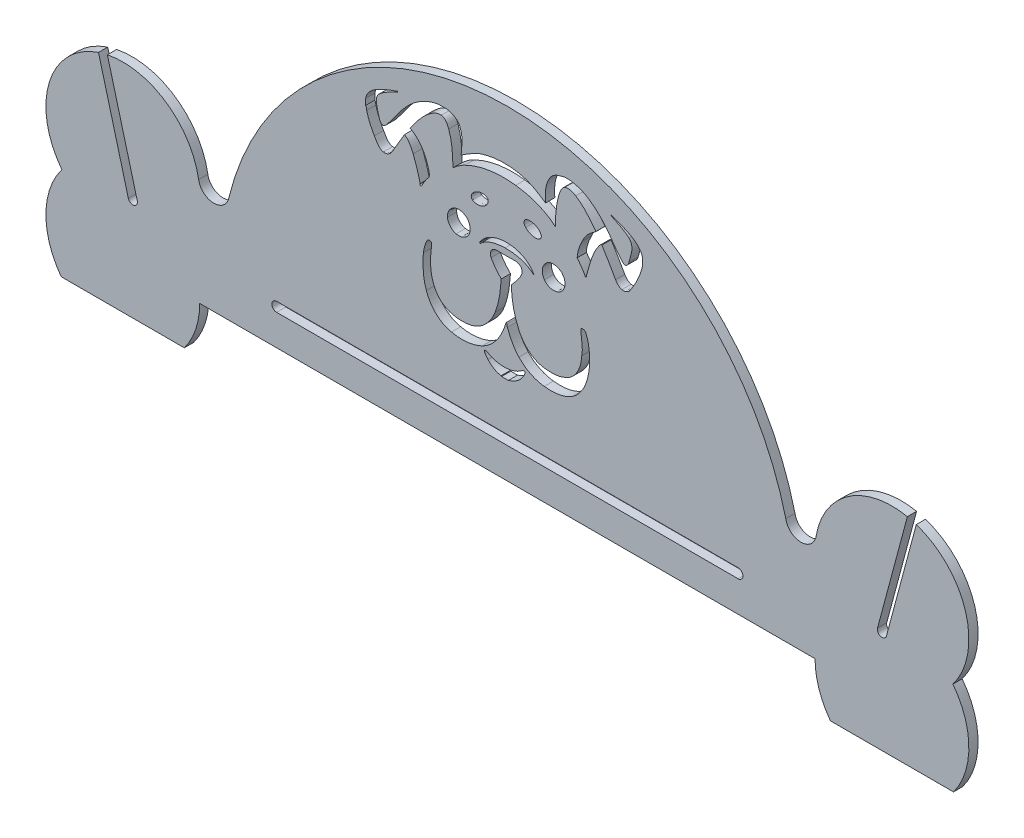
from build123d import *

# Parameters (mm, degrees)
RESSALTO_EXTRUS_O2_DEPTH = 6
RESSALTO_EXTRUS_O4_START = -6
RESSALTO_EXTRUS_O4_DEPTH = 6
CORTE_EXTRUS_O1_DEPTH    = 367.820119404


with BuildPart() as part:
    # Esboço1 → Ressalto-extrusão2 (new body)
    with BuildSketch(Plane.XY):
        with BuildLine():
            Line((-199.999999999, 0), (199.999999999, 0))
            ThreePointArc((199.999999999, 0), (202.565835097, -15.811388301), (209.999999999, -30))
            Line((209.999999999, -30), (289.999999999, -30))
            ThreePointArc((289.999999999, -30), (299.999014124, 0.31398499), (289.62007067, 30.5))
            ThreePointArc((289.62007067, 30.5), (297.818976076, 75.60635228), (265.815415017, 108.432822474))
            Line((265.815415017, 108.432822474), (246.403986634, 35.988385502))
            ThreePointArc((246.403986634, 35.988385502), (242.72975202, 33.867065158), (240.608431676, 37.541299773))
            Line((240.608431676, 37.541299773), (260.019860059, 109.985736744))
            ThreePointArc((260.019860059, 109.985736744), (218.38507475, 99.736242739), (199.999999999, 61))
            Line((199.999999999, 61), (140, 61))
            Line((140, 61), (-199.999999999, 61))
            ThreePointArc((-199.999999999, 61), (-218.38507475, 99.736242739), (-260.019860059, 109.985736744))
            Line((-260.019860059, 109.985736744), (-240.608431676, 37.541299773))
            ThreePointArc((-240.608431676, 37.541299773), (-242.72975202, 33.867065158), (-246.403986634, 35.988385502))
            Line((-246.403986634, 35.988385502), (-265.815415017, 108.432822474))
            ThreePointArc((-265.815415017, 108.432822474), (-297.818976076, 75.60635228), (-289.62007067, 30.5))
            ThreePointArc((-289.62007067, 30.5), (-299.999014124, 0.31398499), (-289.999999999, -30))
            Line((-289.999999999, -30), (-209.999999999, -30))
            ThreePointArc((-209.999999999, -30), (-202.565835097, -15.811388301), (-199.999999999, 0))
        make_face()
        with BuildLine():
            Line((149.999999999, 26.2), (144.152507453, 26.2))
            Line((144.152507453, 26.2), (-144.152507453, 26.2))
            Line((-144.152507453, 26.2), (-149.999999999, 26.2))
            ThreePointArc((-149.999999999, 26.2), (-153.099999999, 23.1), (-149.999999999, 20))
            Line((-149.999999999, 20), (149.999999999, 20))
            ThreePointArc((149.999999999, 20), (153.099999999, 23.1), (149.999999999, 26.2))
        make_face(mode=Mode.SUBTRACT)
    extrude(amount=RESSALTO_EXTRUS_O2_DEPTH)

    # Esboço7 → Ressalto-extrusão4 (add)
    with BuildSketch(Plane.XY.offset(6).offset(RESSALTO_EXTRUS_O4_START)):
        with BuildLine():
            ThreePointArc((-180.979069196, 69.333333333), (-184.384229959, 63.362373812), (-190.83920226, 61))
            Line((-190.83920226, 61), (190.839202168, 61))
            ThreePointArc((190.839202168, 61), (184.384229924, 63.362373842), (180.979069196, 69.333333333))
            ThreePointArc((180.979069196, 69.333333333), (0, 211), (-180.979069196, 69.333333333))
        make_face()
        with BuildLine():
            ThreePointArc((200.69933514, 69.333333333), (197.294174412, 63.362373842), (190.839202168, 61))
            Line((190.839202168, 61), (199.999999999, 61))
            ThreePointArc((199.999999999, 61), (200.175140526, 65.181313014), (200.69933514, 69.333333333))
        make_face()
        with BuildLine():
            ThreePointArc((200.69933514, 69.333333333), (200.175140526, 65.181313014), (199.999999999, 61))
            Line((199.999999999, 61), (209.323153762, 61))
            Line((209.323153762, 61), (200.69933514, 69.333333333))
        make_face()
        with BuildLine():
            ThreePointArc((-200.69933514, 69.333333333), (-200.175140526, 65.181313014), (-199.999999999, 61))
            Line((-199.999999999, 61), (-190.83920226, 61))
            ThreePointArc((-190.83920226, 61), (-197.294174447, 63.362373871), (-200.69933514, 69.333333333))
        make_face()
        with BuildLine():
            Line((-204.602499399, 61), (-199.999999999, 61))
            ThreePointArc((-199.999999999, 61), (-200.175140526, 65.181313014), (-200.69933514, 69.333333333))
            Line((-200.69933514, 69.333333333), (-204.602499399, 69.333333333))
            Line((-204.602499399, 69.333333333), (-204.602499399, 61))
        make_face()
    extrude(amount=RESSALTO_EXTRUS_O4_DEPTH)

    # Esboço8 → Corte-extrusão1 (cut, through all)
    with BuildSketch(Plane.XY.offset(6)):
        with BuildLine():
            Line((-44.7783, 189.738352158), (-39.1773, 189.738352158))
            add(Edge.make_bspline(
                [(-39.1773, 189.738352158), (-36.0719, 189.018252158), (-32.5885, 187.728852158), (-31.1078, 184.634952158)],
                knots=[0.016129032, 0.016129032, 0.016129032, 0.016129032, 0.032258065, 0.032258065, 0.032258065, 0.032258065], degree=3))
            add(Edge.make_bspline(
                [(-31.1078, 184.634952158), (-28.6572, 179.668352158), (-29.5867, 173.860352158), (-30.0502, 168.542852158)],
                knots=[0.032258065, 0.032258065, 0.032258065, 0.032258065, 0.048387097, 0.048387097, 0.048387097, 0.048387097], degree=3))
            add(Edge.make_bspline(
                [(-30.0502, 168.542852158), (-25.9705, 171.070052158), (-21.9875, 173.936952158), (-17.4035, 175.525652158)],
                knots=[0.048387097, 0.048387097, 0.048387097, 0.048387097, 0.064516129, 0.064516129, 0.064516129, 0.064516129], degree=3))
            add(Edge.make_bspline(
                [(-17.4035, 175.525652158), (-7.8804, 178.617552158), (2.7207, 178.930152158), (12.2934, 175.845152158)],
                knots=[0.064516129, 0.064516129, 0.064516129, 0.064516129, 0.080645161, 0.080645161, 0.080645161, 0.080645161], degree=3))
            add(Edge.make_bspline(
                [(12.2934, 175.845152158), (16.8276, 174.256452158), (20.8602, 171.585452158), (24.8432, 168.970552158)],
                knots=[0.080645161, 0.080645161, 0.080645161, 0.080645161, 0.096774194, 0.096774194, 0.096774194, 0.096774194], degree=3))
            add(Edge.make_bspline(
                [(24.8432, 168.970552158), (24.4225, 174.670552158), (24.6092, 181.050252158), (28.5111, 185.633952158)],
                knots=[0.096774194, 0.096774194, 0.096774194, 0.096774194, 0.112903226, 0.112903226, 0.112903226, 0.112903226], degree=3))
            add(Edge.make_bspline(
                [(28.5111, 185.633952158), (30.6353, 188.264452158), (34.0312, 189.000152158), (37.1274, 189.738352158)],
                knots=[0.112903226, 0.112903226, 0.112903226, 0.112903226, 0.129032258, 0.129032258, 0.129032258, 0.129032258], degree=3))
            Line((37.1274, 189.738352158), (41.16, 189.738352158))
            add(Edge.make_bspline(
                [(41.16, 189.738352158), (43.8266, 189.027352158), (46.7114, 188.662752158), (49.2047, 187.305852158)],
                knots=[0.14516129, 0.14516129, 0.14516129, 0.14516129, 0.161290323, 0.161290323, 0.161290323, 0.161290323], degree=3))
            add(Edge.make_bspline(
                [(49.2047, 187.305852158), (55.9174, 184.083252158), (61.3586, 178.727852158), (65.742, 172.795952158)],
                knots=[0.161290323, 0.161290323, 0.161290323, 0.161290323, 0.177419355, 0.177419355, 0.177419355, 0.177419355], degree=3))
            add(Edge.make_bspline(
                [(65.742, 172.795952158), (68.8317, 168.698252158), (71.4938, 164.213452158), (75.1032, 160.545552158)],
                knots=[0.177419355, 0.177419355, 0.177419355, 0.177419355, 0.193548387, 0.193548387, 0.193548387, 0.193548387], degree=3))
            add(Edge.make_bspline(
                [(75.1032, 160.545552158), (76.8765, 158.596652158), (78.7081, 161.058452158), (79.039, 162.804652158)],
                knots=[0.193548387, 0.193548387, 0.193548387, 0.193548387, 0.209677419, 0.209677419, 0.209677419, 0.209677419], degree=3))
            add(Edge.make_bspline(
                [(79.039, 162.804652158), (80.0583, 167.039752158), (82.6957, 172.561952158), (79.1313, 176.274852158)],
                knots=[0.209677419, 0.209677419, 0.209677419, 0.209677419, 0.225806452, 0.225806452, 0.225806452, 0.225806452], degree=3))
            add(Edge.make_bspline(
                [(79.1313, 176.274852158), (76.2463, 178.937152158), (72.6324, 180.584152158), (69.1196, 182.242652158)],
                knots=[0.225806452, 0.225806452, 0.225806452, 0.225806452, 0.241935484, 0.241935484, 0.241935484, 0.241935484], degree=3))
            add(Edge.make_bspline(
                [(69.1196, 182.242652158), (68.521, 182.598252158), (67.567, 182.717652158), (67.3555, 183.457752158)],
                knots=[0.241935484, 0.241935484, 0.241935484, 0.241935484, 0.258064516, 0.258064516, 0.258064516, 0.258064516], degree=3))
            add(Edge.make_bspline(
                [(67.3555, 183.457752158), (70.8704, 182.611652158), (74.2684, 181.173752158), (77.5561, 179.652752158)],
                knots=[0.258064516, 0.258064516, 0.258064516, 0.258064516, 0.274193548, 0.274193548, 0.274193548, 0.274193548], degree=3))
            add(Edge.make_bspline(
                [(77.5561, 179.652752158), (81.8832, 177.559752158), (86.5324, 174.722352158), (87.8647, 169.798652158)],
                knots=[0.274193548, 0.274193548, 0.274193548, 0.274193548, 0.290322581, 0.290322581, 0.290322581, 0.290322581], degree=3))
            Line((87.8647, 169.798652158), (87.8647, 165.109152158))
            add(Edge.make_bspline(
                [(87.8647, 165.109152158), (86.4175, 158.643952158), (83.4383, 152.534452158), (79.6892, 147.066452158)],
                knots=[0.306451613, 0.306451613, 0.306451613, 0.306451613, 0.322580645, 0.322580645, 0.322580645, 0.322580645], degree=3))
            add(Edge.make_bspline(
                [(79.6892, 147.066452158), (78.4066, 145.596952158), (76.4669, 144.541452158), (74.4596, 145.047752158)],
                knots=[0.322580645, 0.322580645, 0.322580645, 0.322580645, 0.338709677, 0.338709677, 0.338709677, 0.338709677], degree=3))
            add(Edge.make_bspline(
                [(74.4596, 145.047752158), (72.6009, 145.457352158), (71.1877, 146.917752158), (70.2989, 148.542352158)],
                knots=[0.338709677, 0.338709677, 0.338709677, 0.338709677, 0.35483871, 0.35483871, 0.35483871, 0.35483871], degree=3))
            add(Edge.make_bspline(
                [(70.2989, 148.542352158), (67.4612, 153.616852158), (64.5921, 158.682252158), (61.4305, 163.565352158)],
                knots=[0.35483871, 0.35483871, 0.35483871, 0.35483871, 0.370967742, 0.370967742, 0.370967742, 0.370967742], degree=3))
            add(Edge.make_bspline(
                [(61.4305, 163.565352158), (60.6811, 163.873552158), (60.3009, 162.807052158), (59.7967, 162.455952158)],
                knots=[0.370967742, 0.370967742, 0.370967742, 0.370967742, 0.387096774, 0.387096774, 0.387096774, 0.387096774], degree=3))
            add(Edge.make_bspline(
                [(59.7967, 162.455952158), (55.204, 156.524152158), (53.5433, 149.001552158), (51.5427, 141.926752158)],
                knots=[0.387096774, 0.387096774, 0.387096774, 0.387096774, 0.403225806, 0.403225806, 0.403225806, 0.403225806], degree=3))
            add(Edge.make_bspline(
                [(51.5427, 141.926752158), (51.3402, 141.751252158), (51.4618, 139.658352158), (50.6921, 140.405452158)],
                knots=[0.403225806, 0.403225806, 0.403225806, 0.403225806, 0.419354839, 0.419354839, 0.419354839, 0.419354839], degree=3))
            add(Edge.make_bspline(
                [(50.6921, 140.405452158), (49.2295, 143.265652158), (47.2987, 145.846652158), (45.4017, 148.412052158)],
                knots=[0.419354839, 0.419354839, 0.419354839, 0.419354839, 0.435483871, 0.435483871, 0.435483871, 0.435483871], degree=3))
            add(Edge.make_bspline(
                [(45.4017, 148.412052158), (45.4469, 152.230852158), (46.9252, 155.858252158), (48.5903, 159.238052158)],
                knots=[0.435483871, 0.435483871, 0.435483871, 0.435483871, 0.451612903, 0.451612903, 0.451612903, 0.451612903], degree=3))
            add(Edge.make_bspline(
                [(48.5903, 159.238052158), (50.2039, 162.833852158), (52.7737, 166.029452158), (56.1445, 168.115352158)],
                knots=[0.451612903, 0.451612903, 0.451612903, 0.451612903, 0.467741935, 0.467741935, 0.467741935, 0.467741935], degree=3))
            add(Edge.make_bspline(
                [(56.1445, 168.115352158), (56.6105, 168.452952158), (57.2135, 168.720752158), (57.5127, 169.251852158)],
                knots=[0.467741935, 0.467741935, 0.467741935, 0.467741935, 0.483870968, 0.483870968, 0.483870968, 0.483870968], degree=3))
            add(Edge.make_bspline(
                [(57.5127, 169.251852158), (53.7818, 174.272152158), (49.801, 179.400652158), (44.4432, 182.776152158)],
                knots=[0.483870968, 0.483870968, 0.483870968, 0.483870968, 0.5, 0.5, 0.5, 0.5], degree=3))
            add(Edge.make_bspline(
                [(44.4432, 182.776152158), (41.9363, 184.263352158), (38.1514, 185.573152158), (35.9326, 182.942452158)],
                knots=[0.5, 0.5, 0.5, 0.5, 0.516129032, 0.516129032, 0.516129032, 0.516129032], degree=3))
            add(Edge.make_bspline(
                [(35.9326, 182.942452158), (33.626, 179.947552158), (32.987, 176.130852158), (32.2263, 172.523752158)],
                knots=[0.516129032, 0.516129032, 0.516129032, 0.516129032, 0.532258065, 0.532258065, 0.532258065, 0.532258065], degree=3))
            add(Edge.make_bspline(
                [(32.2263, 172.523752158), (31.6682, 167.991552158), (31.0832, 163.448452158), (31.1304, 158.866852158)],
                knots=[0.532258065, 0.532258065, 0.532258065, 0.532258065, 0.548387097, 0.548387097, 0.548387097, 0.548387097], degree=3))
            add(Edge.make_bspline(
                [(31.1304, 158.866852158), (23.9992, 165.030352158), (14.7191, 168.072652158), (5.4819, 169.238252158)],
                knots=[0.548387097, 0.548387097, 0.548387097, 0.548387097, 0.564516129, 0.564516129, 0.564516129, 0.564516129], degree=3))
            add(Edge.make_bspline(
                [(5.4819, 169.238252158), (-5.6999, 170.565852158), (-17.4081, 169.132552158), (-27.5524, 164.053652158)],
                knots=[0.564516129, 0.564516129, 0.564516129, 0.564516129, 0.580645161, 0.580645161, 0.580645161, 0.580645161], degree=3))
            add(Edge.make_bspline(
                [(-27.5524, 164.053652158), (-30.4733, 162.701352158), (-33.0521, 160.766052158), (-35.4149, 158.607852158)],
                knots=[0.580645161, 0.580645161, 0.580645161, 0.580645161, 0.596774194, 0.596774194, 0.596774194, 0.596774194], degree=3))
            add(Edge.make_bspline(
                [(-35.4149, 158.607852158), (-35.5071, 165.513952158), (-35.8267, 172.584652158), (-38.1556, 179.159852158)],
                knots=[0.596774194, 0.596774194, 0.596774194, 0.596774194, 0.612903226, 0.612903226, 0.612903226, 0.612903226], degree=3))
            add(Edge.make_bspline(
                [(-38.1556, 179.159852158), (-39.0356, 181.396652158), (-40.3071, 184.108052158), (-42.96, 184.477252158)],
                knots=[0.612903226, 0.612903226, 0.612903226, 0.612903226, 0.629032258, 0.629032258, 0.629032258, 0.629032258], degree=3))
            add(Edge.make_bspline(
                [(-42.96, 184.477252158), (-45.8202, 184.706652158), (-48.3405, 183.030352158), (-50.5817, 181.471052158)],
                knots=[0.629032258, 0.629032258, 0.629032258, 0.629032258, 0.64516129, 0.64516129, 0.64516129, 0.64516129], degree=3))
            add(Edge.make_bspline(
                [(-50.5817, 181.471052158), (-55.6877, 177.514752158), (-59.6886, 172.334852158), (-63.3206, 167.044252158)],
                knots=[0.64516129, 0.64516129, 0.64516129, 0.64516129, 0.661290323, 0.661290323, 0.661290323, 0.661290323], degree=3))
            add(Edge.make_bspline(
                [(-63.3206, 167.044252158), (-56.2771, 163.675552158), (-52.7083, 156.114752158), (-50.8856, 148.902552158)],
                knots=[0.661290323, 0.661290323, 0.661290323, 0.661290323, 0.677419355, 0.677419355, 0.677419355, 0.677419355], degree=3))
            add(Edge.make_bspline(
                [(-50.8856, 148.902552158), (-50.8067, 147.624352158), (-50.2847, 145.921052158), (-51.4616, 144.989352158)],
                knots=[0.677419355, 0.677419355, 0.677419355, 0.677419355, 0.693548387, 0.693548387, 0.693548387, 0.693548387], degree=3))
            add(Edge.make_bspline(
                [(-51.4616, 144.989352158), (-53.1719, 142.945952158), (-54.5467, 140.643952158), (-55.7957, 138.296852158)],
                knots=[0.693548387, 0.693548387, 0.693548387, 0.693548387, 0.709677419, 0.709677419, 0.709677419, 0.709677419], degree=3))
            add(Edge.make_bspline(
                [(-55.7957, 138.296852158), (-56.0027, 137.619652158), (-57.5712, 138.011052158), (-56.6598, 139.091252158)],
                knots=[0.709677419, 0.709677419, 0.709677419, 0.709677419, 0.725806452, 0.725806452, 0.725806452, 0.725806452], degree=3))
            add(Edge.make_bspline(
                [(-56.6598, 139.091252158), (-57.938, 144.003752158), (-59.2454, 148.947552158), (-61.2414, 153.625752158)],
                knots=[0.725806452, 0.725806452, 0.725806452, 0.725806452, 0.741935484, 0.741935484, 0.741935484, 0.741935484], degree=3))
            add(Edge.make_bspline(
                [(-61.2414, 153.625752158), (-62.65, 156.517552158), (-63.9754, 159.987452158), (-66.8963, 161.598652158)],
                knots=[0.741935484, 0.741935484, 0.741935484, 0.741935484, 0.758064516, 0.758064516, 0.758064516, 0.758064516], degree=3))
            add(Edge.make_bspline(
                [(-66.8963, 161.598652158), (-69.349, 157.883452158), (-71.4644, 153.961052158), (-73.6674, 150.095152158)],
                knots=[0.758064516, 0.758064516, 0.758064516, 0.758064516, 0.774193548, 0.774193548, 0.774193548, 0.774193548], degree=3))
            add(Edge.make_bspline(
                [(-73.6674, 150.095152158), (-74.8961, 147.394752158), (-77.2274, 144.278052158), (-80.6455, 144.991652158)],
                knots=[0.774193548, 0.774193548, 0.774193548, 0.774193548, 0.790322581, 0.790322581, 0.790322581, 0.790322581], degree=3))
            add(Edge.make_bspline(
                [(-80.6455, 144.991652158), (-83.7171, 145.572152158), (-84.9706, 148.738252158), (-86.4671, 151.085252158)],
                knots=[0.790322581, 0.790322581, 0.790322581, 0.790322581, 0.806451613, 0.806451613, 0.806451613, 0.806451613], degree=3))
            add(Edge.make_bspline(
                [(-86.4671, 151.085252158), (-88.571, 154.832052158), (-90.5198, 158.747452158), (-91.4648, 162.962352158)],
                knots=[0.806451613, 0.806451613, 0.806451613, 0.806451613, 0.822580645, 0.822580645, 0.822580645, 0.822580645], degree=3))
            add(Edge.make_bspline(
                [(-91.4648, 162.962352158), (-91.6765, 163.761052158), (-91.5278, 164.712952158), (-92.1581, 165.342952158)],
                knots=[0.822580645, 0.822580645, 0.822580645, 0.822580645, 0.838709677, 0.838709677, 0.838709677, 0.838709677], degree=3))
            Line((-92.1581, 165.342952158), (-92.1581, 169.364352158))
            add(Edge.make_bspline(
                [(-92.1581, 169.364352158), (-91.1228, 174.821352158), (-85.8324, 177.771352158), (-81.1811, 179.911452158)],
                knots=[0.85483871, 0.85483871, 0.85483871, 0.85483871, 0.870967742, 0.870967742, 0.870967742, 0.870967742], degree=3))
            add(Edge.make_bspline(
                [(-81.1811, 179.911452158), (-78.3773, 181.288552158), (-75.4203, 182.310252158), (-72.4703, 183.307252158)],
                knots=[0.870967742, 0.870967742, 0.870967742, 0.870967742, 0.887096774, 0.887096774, 0.887096774, 0.887096774], degree=3))
            add(Edge.make_bspline(
                [(-72.4703, 183.307252158), (-71.0031, 184.434552158), (-71.2753, 183.014452158), (-71.8853, 182.951552158)],
                knots=[0.887096774, 0.887096774, 0.887096774, 0.887096774, 0.903225806, 0.903225806, 0.903225806, 0.903225806], degree=3))
            add(Edge.make_bspline(
                [(-71.8853, 182.951552158), (-75.8951, 181.072452158), (-80.0694, 179.234152158), (-83.3594, 176.216452158)],
                knots=[0.903225806, 0.903225806, 0.903225806, 0.903225806, 0.919354839, 0.919354839, 0.919354839, 0.919354839], degree=3))
            add(Edge.make_bspline(
                [(-83.3594, 176.216452158), (-86.3657, 173.498252158), (-84.9346, 169.188952158), (-84.1807, 165.797652158)],
                knots=[0.919354839, 0.919354839, 0.919354839, 0.919354839, 0.935483871, 0.935483871, 0.935483871, 0.935483871], degree=3))
            add(Edge.make_bspline(
                [(-84.1807, 165.797652158), (-83.4809, 163.882752158), (-83.3795, 161.513052158), (-81.7302, 160.108852158)],
                knots=[0.935483871, 0.935483871, 0.935483871, 0.935483871, 0.951612903, 0.951612903, 0.951612903, 0.951612903], degree=3))
            add(Edge.make_bspline(
                [(-81.7302, 160.108852158), (-80.5893, 159.258252158), (-79.2908, 160.471252158), (-78.5842, 161.312852158)],
                knots=[0.951612903, 0.951612903, 0.951612903, 0.951612903, 0.967741935, 0.967741935, 0.967741935, 0.967741935], degree=3))
            add(Edge.make_bspline(
                [(-78.5842, 161.312852158), (-73.9014, 166.459252158), (-70.724, 172.822952158), (-65.8049, 177.782552158)],
                knots=[0.967741935, 0.967741935, 0.967741935, 0.967741935, 0.983870968, 0.983870968, 0.983870968, 0.983870968], degree=3))
            add(Edge.make_bspline(
                [(-65.8049, 177.782552158), (-60.2962, 183.858452158), (-52.9423, 188.505252158), (-44.7783, 189.738352158)],
                knots=[0.983870968, 0.983870968, 0.983870968, 0.983870968, 1, 1, 1, 1], degree=3))
        make_face()
        with BuildLine():
            Line((0.6392, 56.971752158), (-3.8029, 56.971752158))
            add(Edge.make_bspline(
                [(-3.8029, 56.971752158), (-3.866, 57.057252158), (-3.9942, 57.230552158), (-4.0572, 57.316052158)],
                knots=[0.444444444, 0.444444444, 0.444444444, 0.444444444, 0.555555556, 0.555555556, 0.555555556, 0.555555556], degree=3))
            add(Edge.make_bspline(
                [(-4.0572, 57.316052158), (-7.3921, 57.675952158), (-10.3468, 59.651852158), (-12.5632, 62.084552158)],
                knots=[0.555555556, 0.555555556, 0.555555556, 0.555555556, 0.666666667, 0.666666667, 0.666666667, 0.666666667], degree=3))
            add(Edge.make_bspline(
                [(-12.5632, 62.084552158), (-13.4003, 63.337752158), (-15.3243, 64.710452158), (-14.7101, 66.411752158)],
                knots=[0.666666667, 0.666666667, 0.666666667, 0.666666667, 0.777777778, 0.777777778, 0.777777778, 0.777777778], degree=3))
            add(Edge.make_bspline(
                [(-14.7101, 66.411752158), (-12.9637, 66.695152158), (-11.7577, 65.138152158), (-10.1599, 64.735352158)],
                knots=[0.777777778, 0.777777778, 0.777777778, 0.777777778, 0.888888889, 0.888888889, 0.888888889, 0.888888889], degree=3))
            add(Edge.make_bspline(
                [(-10.1599, 64.735352158), (-3.5959, 62.106852158), (4.4444, 62.718952158), (10.0184, 67.286952158)],
                knots=[0.888888889, 0.888888889, 0.888888889, 0.888888889, 1, 1, 1, 1], degree=3))
            add(Edge.make_bspline(
                [(10.0184, 67.286952158), (10.3535, 67.298152158), (11.022, 67.318552158), (11.355, 67.329752158)],
                knots=[0, 0, 0, 0, 0.111111111, 0.111111111, 0.111111111, 0.111111111], degree=3))
            add(Edge.make_bspline(
                [(11.355, 67.329752158), (11.6588, 65.515952158), (10.3267, 64.150352158), (9.4153, 62.746152158)],
                knots=[0.111111111, 0.111111111, 0.111111111, 0.111111111, 0.222222222, 0.222222222, 0.222222222, 0.222222222], degree=3))
            add(Edge.make_bspline(
                [(9.4153, 62.746152158), (7.3045, 59.811552158), (4.0349, 57.966352158), (0.6392, 56.971752158)],
                knots=[0.222222222, 0.222222222, 0.222222222, 0.222222222, 0.333333333, 0.333333333, 0.333333333, 0.333333333], degree=3))
        make_face()
        with BuildLine():
            add(Edge.make_bspline(
                [(-18.2609, 153.639452158), (-16.265, 153.841752158), (-13.8459, 154.249052158), (-12.534, 152.318452158)],
                knots=[0, 0, 0, 0, 0.25, 0.25, 0.25, 0.25], degree=3))
            add(Edge.make_bspline(
                [(-12.534, 152.318452158), (-11.7285, 147.349852158), (-19.0688, 144.464852158), (-22.6873, 146.913352158)],
                knots=[0.25, 0.25, 0.25, 0.25, 0.5, 0.5, 0.5, 0.5], degree=3))
            add(Edge.make_bspline(
                [(-22.6873, 146.913352158), (-23.7629, 147.745952158), (-23.6819, 149.426752158), (-22.9416, 150.448452158)],
                knots=[0.5, 0.5, 0.5, 0.5, 0.75, 0.75, 0.75, 0.75], degree=3))
            add(Edge.make_bspline(
                [(-22.9416, 150.448452158), (-21.893, 152.111552158), (-20.0027, 152.901352158), (-18.2609, 153.639452158)],
                knots=[0.75, 0.75, 0.75, 0.75, 1, 1, 1, 1], degree=3))
        make_face()
        with BuildLine():
            add(Edge.make_bspline(
                [(12.7861, 153.657352158), (16.0017, 154.294152158), (20.0275, 153.115052158), (21.6524, 150.104152158)],
                knots=[0, 0, 0, 0, 0.25, 0.25, 0.25, 0.25], degree=3))
            add(Edge.make_bspline(
                [(21.6524, 150.104152158), (22.4804, 148.801252158), (21.9921, 146.908852158), (20.4619, 146.397952158)],
                knots=[0.25, 0.25, 0.25, 0.25, 0.5, 0.5, 0.5, 0.5], degree=3))
            add(Edge.make_bspline(
                [(20.4619, 146.397952158), (17.4735, 145.342652158), (13.9159, 146.478852158), (11.8522, 148.830552158)],
                knots=[0.5, 0.5, 0.5, 0.5, 0.75, 0.75, 0.75, 0.75], degree=3))
            add(Edge.make_bspline(
                [(11.8522, 148.830552158), (10.2006, 150.218952158), (10.617, 153.148752158), (12.7861, 153.657352158)],
                knots=[0.75, 0.75, 0.75, 0.75, 1, 1, 1, 1], degree=3))
        make_face()
        with BuildLine():
            add(Edge.make_bspline(
                [(-33.1129, 136.982752158), (-30.4395, 137.597152158), (-27.6942, 136.447252158), (-25.8309, 134.559152158)],
                knots=[0, 0, 0, 0, 0.2, 0.2, 0.2, 0.2], degree=3))
            add(Edge.make_bspline(
                [(-25.8309, 134.559152158), (-24.3953, 132.448252158), (-23.5785, 129.626652158), (-24.6316, 127.171552158)],
                knots=[0.2, 0.2, 0.2, 0.2, 0.4, 0.4, 0.4, 0.4], degree=3))
            add(Edge.make_bspline(
                [(-24.6316, 127.171552158), (-25.7477, 123.751152158), (-29.8454, 121.651752158), (-33.2883, 122.572152158)],
                knots=[0.4, 0.4, 0.4, 0.4, 0.6, 0.6, 0.6, 0.6], degree=3))
            add(Edge.make_bspline(
                [(-33.2883, 122.572152158), (-36.3037, 123.197652158), (-38.698, 126.001452158), (-38.9569, 129.066252158)],
                knots=[0.6, 0.6, 0.6, 0.6, 0.8, 0.8, 0.8, 0.8], degree=3))
            add(Edge.make_bspline(
                [(-38.9569, 129.066252158), (-39.2471, 132.639652158), (-36.675, 136.276352158), (-33.1129, 136.982752158)],
                knots=[0.8, 0.8, 0.8, 0.8, 1, 1, 1, 1], degree=3))
        make_face()
        with BuildLine():
            add(Edge.make_bspline(
                [(28.3221, 136.980452158), (31.279, 137.498152158), (34.8096, 136.454152158), (36.2836, 133.656952158)],
                knots=[0, 0, 0, 0, 0.25, 0.25, 0.25, 0.25], degree=3))
            add(Edge.make_bspline(
                [(36.2836, 133.656952158), (38.1108, 131.098252158), (37.8025, 127.407752158), (35.7682, 125.056452158)],
                knots=[0.25, 0.25, 0.25, 0.25, 0.5, 0.5, 0.5, 0.5], degree=3))
            add(Edge.make_bspline(
                [(35.7682, 125.056452158), (32.906, 121.361352158), (26.6592, 121.474052158), (24.0421, 125.461252158)],
                knots=[0.5, 0.5, 0.5, 0.5, 0.75, 0.75, 0.75, 0.75], degree=3))
            add(Edge.make_bspline(
                [(24.0421, 125.461252158), (20.9682, 129.516352158), (23.4098, 135.823752158), (28.3221, 136.980452158)],
                knots=[0.75, 0.75, 0.75, 0.75, 1, 1, 1, 1], degree=3))
        make_face()
        with BuildLine():
            add(Edge.make_bspline(
                [(-4.3025, 133.821152158), (3.6545, 134.950852158), (12.9077, 132.477652158), (17.1742, 125.128252158)],
                knots=[0, 0, 0, 0, 0.166666667, 0.166666667, 0.166666667, 0.166666667], degree=3))
            add(Edge.make_bspline(
                [(17.1742, 125.128252158), (17.4038, 124.727852158), (16.6049, 124.952752158), (16.4744, 125.105852158)],
                knots=[0.166666667, 0.166666667, 0.166666667, 0.166666667, 0.333333333, 0.333333333, 0.333333333, 0.333333333], degree=3))
            add(Edge.make_bspline(
                [(16.4744, 125.105852158), (11.6453, 129.475852158), (4.7999, 130.569552158), (-1.4693, 130.533652158)],
                knots=[0.333333333, 0.333333333, 0.333333333, 0.333333333, 0.5, 0.5, 0.5, 0.5], degree=3))
            add(Edge.make_bspline(
                [(-1.4693, 130.533652158), (-6.9082, 130.369252158), (-12.705, 129.187752158), (-16.94, 125.551552158)],
                knots=[0.5, 0.5, 0.5, 0.5, 0.666666667, 0.666666667, 0.666666667, 0.666666667], degree=3))
            add(Edge.make_bspline(
                [(-16.94, 125.551552158), (-17.1605, 125.204852158), (-18.0428, 124.540952158), (-18.1237, 125.153052158)],
                knots=[0.666666667, 0.666666667, 0.666666667, 0.666666667, 0.833333333, 0.833333333, 0.833333333, 0.833333333], degree=3))
            add(Edge.make_bspline(
                [(-18.1237, 125.153052158), (-15.3919, 130.119552158), (-9.8021, 132.977252158), (-4.3025, 133.821152158)],
                knots=[0.833333333, 0.833333333, 0.833333333, 0.833333333, 1, 1, 1, 1], degree=3))
        make_face()
        with BuildLine():
            add(Edge.make_bspline(
                [(-7.4596, 126.406452158), (-3.3709, 126.636052158), (0.736, 126.444652158), (4.8314, 126.509952158)],
                knots=[0, 0, 0, 0, 0.035714286, 0.035714286, 0.035714286, 0.035714286], degree=3))
            add(Edge.make_bspline(
                [(4.8314, 126.509952158), (6.2379, 126.478552158), (7.7972, 126.111752158), (8.7515, 125.018052158)],
                knots=[0.035714286, 0.035714286, 0.035714286, 0.035714286, 0.071428571, 0.071428571, 0.071428571, 0.071428571], degree=3))
            add(Edge.make_bspline(
                [(8.7515, 125.018052158), (9.9283, 123.445052158), (9.593, 121.347752158), (8.6861, 119.727652158)],
                knots=[0.071428571, 0.071428571, 0.071428571, 0.071428571, 0.107142857, 0.107142857, 0.107142857, 0.107142857], degree=3))
            add(Edge.make_bspline(
                [(8.6861, 119.727652158), (7.0592, 116.809052158), (4.8156, 114.306552158), (2.6396, 111.793152158)],
                knots=[0.107142857, 0.107142857, 0.107142857, 0.107142857, 0.142857143, 0.142857143, 0.142857143, 0.142857143], degree=3))
            add(Edge.make_bspline(
                [(2.6396, 111.793152158), (2.7364, 104.065552158), (4.0664, 96.234752158), (7.3451, 89.184452158)],
                knots=[0.142857143, 0.142857143, 0.142857143, 0.142857143, 0.178571429, 0.178571429, 0.178571429, 0.178571429], degree=3))
            add(Edge.make_bspline(
                [(7.3451, 89.184452158), (10.187, 82.456052158), (16.1752, 76.751652158), (23.5719, 75.712152158)],
                knots=[0.178571429, 0.178571429, 0.178571429, 0.178571429, 0.214285714, 0.214285714, 0.214285714, 0.214285714], degree=3))
            add(Edge.make_bspline(
                [(23.5719, 75.712152158), (28.0768, 75.147352158), (32.9938, 75.041652158), (37.2332, 76.999352158)],
                knots=[0.214285714, 0.214285714, 0.214285714, 0.214285714, 0.25, 0.25, 0.25, 0.25], degree=3))
            add(Edge.make_bspline(
                [(37.2332, 76.999352158), (44.4071, 79.483552158), (48.0706, 87.393252158), (48.2844, 94.549152158)],
                knots=[0.25, 0.25, 0.25, 0.25, 0.285714286, 0.285714286, 0.285714286, 0.285714286], degree=3))
            add(Edge.make_bspline(
                [(48.2844, 94.549152158), (49.4951, 99.605552158), (47.67, 104.727152158), (47.841, 109.810552158)],
                knots=[0.285714286, 0.285714286, 0.285714286, 0.285714286, 0.321428571, 0.321428571, 0.321428571, 0.321428571], degree=3))
            add(Edge.make_bspline(
                [(47.841, 109.810552158), (49.0113, 110.469752158), (50.5527, 110.112252158), (51.0431, 108.806952158)],
                knots=[0.321428571, 0.321428571, 0.321428571, 0.321428571, 0.357142857, 0.357142857, 0.357142857, 0.357142857], degree=3))
            add(Edge.make_bspline(
                [(51.0431, 108.806952158), (53.3542, 103.577352158), (53.5005, 97.724452158), (53.3879, 92.100752158)],
                knots=[0.357142857, 0.357142857, 0.357142857, 0.357142857, 0.392857143, 0.392857143, 0.392857143, 0.392857143], degree=3))
            add(Edge.make_bspline(
                [(53.3879, 92.100752158), (52.9357, 83.489052158), (49.8821, 74.177452158), (42.5642, 68.979352158)],
                knots=[0.392857143, 0.392857143, 0.392857143, 0.392857143, 0.428571429, 0.428571429, 0.428571429, 0.428571429], degree=3))
            add(Edge.make_bspline(
                [(42.5642, 68.979352158), (37.1455, 65.320452158), (30.2754, 64.489952158), (23.9543, 65.286552158)],
                knots=[0.428571429, 0.428571429, 0.428571429, 0.428571429, 0.464285714, 0.464285714, 0.464285714, 0.464285714], degree=3))
            add(Edge.make_bspline(
                [(23.9543, 65.286552158), (17.7548, 65.977452158), (11.7218, 68.916252158), (7.4755, 73.565452158)],
                knots=[0.464285714, 0.464285714, 0.464285714, 0.464285714, 0.5, 0.5, 0.5, 0.5], degree=3))
            add(Edge.make_bspline(
                [(7.4755, 73.565452158), (3.9943, 77.251352158), (1.6473, 81.837352158), (0, 86.592252158)],
                knots=[0.5, 0.5, 0.5, 0.5, 0.535714286, 0.535714286, 0.535714286, 0.535714286], degree=3))
            add(Edge.make_bspline(
                [(0, 86.592252158), (-0.477, 87.226852158), (0.0181, 89.024652158), (-0.8663, 88.774952158)],
                knots=[0.535714286, 0.535714286, 0.535714286, 0.535714286, 0.571428571, 0.571428571, 0.571428571, 0.571428571], degree=3))
            add(Edge.make_bspline(
                [(-0.8663, 88.774952158), (-3.2336, 80.325152158), (-8.1414, 71.990252158), (-16.274, 67.959752158)],
                knots=[0.571428571, 0.571428571, 0.571428571, 0.571428571, 0.607142857, 0.607142857, 0.607142857, 0.607142857], degree=3))
            add(Edge.make_bspline(
                [(-16.274, 67.959752158), (-22.442, 64.985052158), (-29.7081, 64.192952158), (-36.3533, 65.734452158)],
                knots=[0.607142857, 0.607142857, 0.607142857, 0.607142857, 0.642857143, 0.642857143, 0.642857143, 0.642857143], degree=3))
            add(Edge.make_bspline(
                [(-36.3533, 65.734452158), (-44.092, 67.233052158), (-50.2262, 73.585552158), (-52.6678, 80.966552158)],
                knots=[0.642857143, 0.642857143, 0.642857143, 0.642857143, 0.678571429, 0.678571429, 0.678571429, 0.678571429], degree=3))
            add(Edge.make_bspline(
                [(-52.6678, 80.966552158), (-55.0261, 87.415952158), (-55.1251, 94.394152158), (-54.6503, 101.147152158)],
                knots=[0.678571429, 0.678571429, 0.678571429, 0.678571429, 0.714285714, 0.714285714, 0.714285714, 0.714285714], degree=3))
            add(Edge.make_bspline(
                [(-54.6503, 101.147152158), (-54.126, 104.011652158), (-53.6082, 107.044952158), (-52.0535, 109.576552158)],
                knots=[0.714285714, 0.714285714, 0.714285714, 0.714285714, 0.75, 0.75, 0.75, 0.75], degree=3))
            add(Edge.make_bspline(
                [(-52.0535, 109.576552158), (-51.3131, 110.605052158), (-48.8805, 110.346252158), (-49.218, 108.757452158)],
                knots=[0.75, 0.75, 0.75, 0.75, 0.785714286, 0.785714286, 0.785714286, 0.785714286], degree=3))
            add(Edge.make_bspline(
                [(-49.218, 108.757452158), (-50.3545, 99.657252158), (-50.9666, 89.168852158), (-44.8414, 81.560552158)],
                knots=[0.785714286, 0.785714286, 0.785714286, 0.785714286, 0.821428571, 0.821428571, 0.821428571, 0.821428571], degree=3))
            add(Edge.make_bspline(
                [(-44.8414, 81.560552158), (-39.8209, 75.473552158), (-31.0223, 74.467752158), (-23.7471, 75.894352158)],
                knots=[0.821428571, 0.821428571, 0.821428571, 0.821428571, 0.857142857, 0.857142857, 0.857142857, 0.857142857], degree=3))
            add(Edge.make_bspline(
                [(-23.7471, 75.894352158), (-16.148, 77.645052158), (-10.6168, 84.071952158), (-7.9232, 91.135552158)],
                knots=[0.857142857, 0.857142857, 0.857142857, 0.857142857, 0.892857143, 0.892857143, 0.892857143, 0.892857143], degree=3))
            add(Edge.make_bspline(
                [(-7.9232, 91.135552158), (-5.3645, 97.742252158), (-4.4218, 104.790352158), (-3.9784, 111.813352158)],
                knots=[0.892857143, 0.892857143, 0.892857143, 0.892857143, 0.928571429, 0.928571429, 0.928571429, 0.928571429], degree=3))
            add(Edge.make_bspline(
                [(-3.9784, 111.813352158), (-6.6316, 114.308752158), (-8.8323, 117.331252158), (-10.6168, 120.501652158)],
                knots=[0.928571429, 0.928571429, 0.928571429, 0.928571429, 0.964285714, 0.964285714, 0.964285714, 0.964285714], degree=3))
            add(Edge.make_bspline(
                [(-10.6168, 120.501652158), (-11.9444, 122.920752158), (-10.2702, 126.255652158), (-7.4596, 126.406452158)],
                knots=[0.964285714, 0.964285714, 0.964285714, 0.964285714, 1, 1, 1, 1], degree=3))
        make_face()
    extrude(amount=-CORTE_EXTRUS_O1_DEPTH, mode=Mode.SUBTRACT)


solid = part.part
